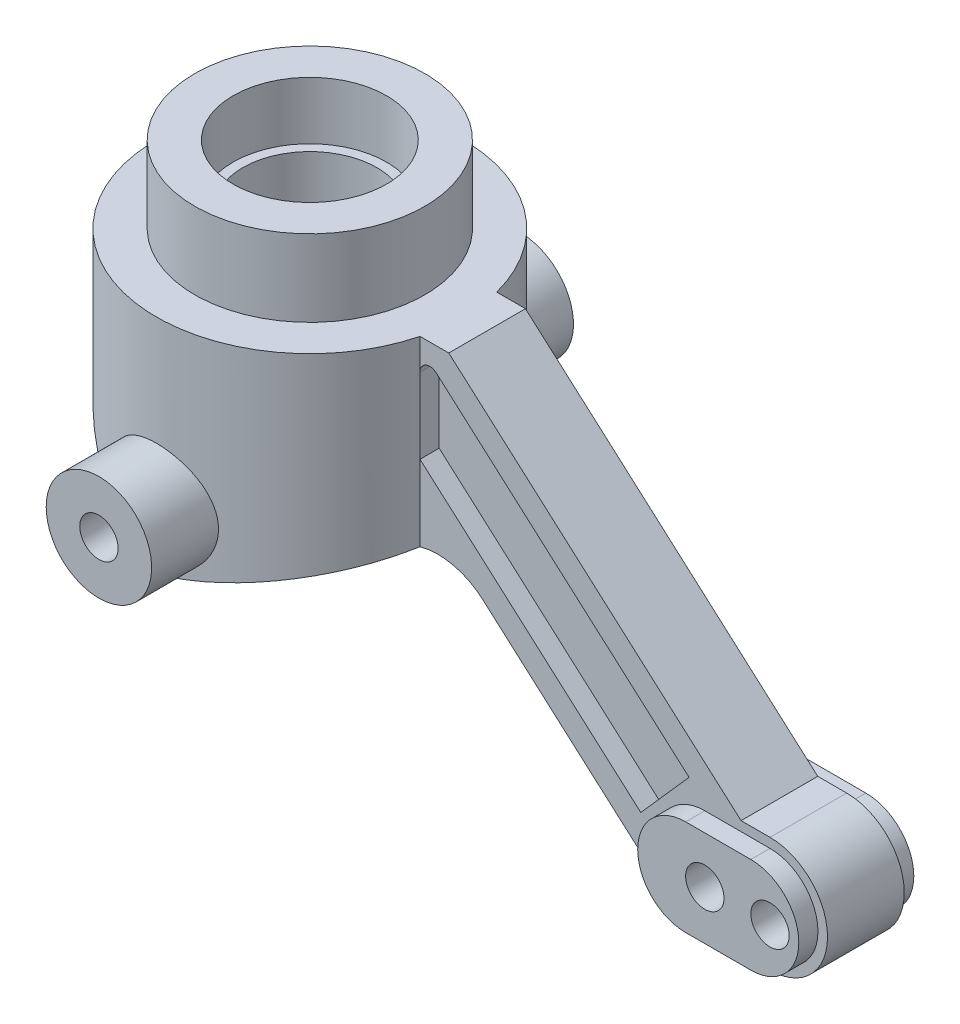
from build123d import *

# Parameters (mm, degrees)
EXTRUDE_1_DEPTH     = 29
CUT_EXTRUDE_1_DEPTH = 29
CUT_EXTRUDE_2_DEPTH = 1
FILLET_1_R          = 0.5
EXTRUDE_2_DEPTH     = 1
SKETCH_7_R          = 2.75
SKETCH_7_R_2        = 1
EXTRUDE_5_DEPTH     = 22
CUT_EXTRUDE_START   = 19
SKETCH_8_R          = 6.25
CUT_EXTRUDE_4_DEPTH = 19
SKETCH_9_R          = 1
CUT_EXTRUDE_5_DEPTH = 18
SKETCH_10_R         = 1
CUT_EXTRUDE_6_DEPTH = 26


with BuildPart() as part:
    # 草图1 → 旋转1 (revolve)
    with BuildSketch(Plane.XY, mode=Mode.PRIVATE) as revolve_1_sk:
        Polygon((4, 0), (4, -3), (3.5, -3), (3.5, -6), (6, -6), (6, -9.5), (6.25, -9.5), (6.25, -16), (8, -16), (8, -4), (6, -4), (6, 0), align=None)
    revolve(revolve_1_sk.sketch.rotate(Axis((0, 0, 0), (0, -1, 0)), 180), axis=Axis((0, 0, 0), (0, -1, 0)))

    # 草图2 → 凸台-拉伸1 (add)
    with BuildSketch(Plane(origin=(0, -4, 0), x_dir=(1, 0, 0), z_dir=(0, 1, 0))):
        with BuildLine():
            Line((7.745966692, 2), (32, 2))
            Line((32, 2), (32, -2))
            Line((32, -2), (7.745966692, -2))
            ThreePointArc((7.745966692, -2), (8, 0), (7.745966692, 2))
        make_face()
    extrude(amount=-EXTRUDE_1_DEPTH)

    # 草图3 → 切除-拉伸1 (cut)
    with BuildSketch(Plane(origin=(0, 0, -12), x_dir=(-1, 0, 0), z_dir=(0, 0, -1))):
        with BuildLine():
            Line((8, -10), (1.860452447, -14.853447831))
            ThreePointArc((1.860452447, -14.853447831), (0.600535009, -15.439278432), (-0.788203157, -15.394604599))
            Line((-0.788203157, -15.394604599), (-7.745966692, -13.5))
            ThreePointArc((-7.745966692, -13.5), (-9.489135576, -13.468262993), (-11.037904709, -14.26886225))
            Line((-11.037904709, -14.26886225), (-20.611161345, -22.746001069))
            ThreePointArc((-20.611161345, -22.746001069), (-21.536515916, -23.305174077), (-22.6, -23.5))
            Line((-22.6, -23.5), (-26, -23.5))
            ThreePointArc((-26, -23.5), (-29, -20.5), (-26, -17.5))
            Line((-26, -17.5), (-24.491554542, -17.5))
            Line((-24.491554542, -17.5), (-9.245966692, -4))
            Line((-9.245966692, -4), (-32, -4))
            Line((-32, -4), (-32, -33))
            Line((-32, -33), (-7.745966692, -33))
            Line((-7.745966692, -33), (-7.745966692, -16))
            Line((-7.745966692, -16), (8, -16))
            Line((8, -16), (8, -10))
        make_face()
    extrude(amount=-CUT_EXTRUDE_1_DEPTH, mode=Mode.SUBTRACT)

    # 草图4 → 切除-拉伸2 (cut)
    with BuildSketch(Plane(origin=(0, 0, -2), x_dir=(-1, 0, 0), z_dir=(0, 0, -1))):
        with BuildLine():
            Line((-19.26013767, -19.746461933), (-21.7793333, -16.901527245))
            Line((-21.7793333, -16.901527245), (-8.595436654, -5.227159128))
            ThreePointArc((-8.595436654, -5.227159128), (-8.047086067, -5.143800877), (-7.745966692, -5.609594916))
            Line((-7.745966692, -5.609594916), (-7.745966692, -9.550639395))
            Line((-7.745966692, -9.550639395), (-19.26013767, -19.746461933))
        make_face()
    cut_extrude_2 = extrude(amount=-CUT_EXTRUDE_2_DEPTH, mode=Mode.SUBTRACT)

    # 圆角1
    fillet_1_edges = [part.edges().sort_by_distance(p)[0] for p in [
        (19.26013767, -19.746461933, -1.5),
        (21.7793333, -16.901527245, -1.5),
    ]]
    fillet(fillet_1_edges, radius=FILLET_1_R)

    # 草图5 → 凸台-拉伸2 (add)
    with BuildSketch(Plane(origin=(0, 0, -2), x_dir=(-1, 0, 0), z_dir=(0, 0, -1))):
        with BuildLine():
            Line((-22.6, -23), (-26, -23))
            ThreePointArc((-26, -23), (-28.5, -20.5), (-26, -18))
            Line((-26, -18), (-22.6, -18))
            ThreePointArc((-22.6, -18), (-20.1, -20.5), (-22.6, -23))
        make_face()
    extrude_2 = extrude(amount=EXTRUDE_2_DEPTH)

    # 镜向1: 切除-拉伸2, 凸台-拉伸2 across plane
    add(cut_extrude_2.mirror(Plane(origin=(0, 0, 0), x_dir=(1, 0, 0), z_dir=(0, 0, -1))), mode=Mode.SUBTRACT)
    add(extrude_2.mirror(Plane(origin=(0, 0, 0), x_dir=(1, 0, 0), z_dir=(0, 0, -1))))

    # 草图7 → 凸台-拉伸5 (add)
    with BuildSketch(Plane(origin=(0, 0, -11), x_dir=(-1, 0, 0), z_dir=(0, 0, -1))):
        with Locations((0, -12.45)):
            Circle(SKETCH_7_R)
        with Locations((0, -12.45)):
            Circle(SKETCH_7_R_2, mode=Mode.SUBTRACT)
    extrude(amount=-EXTRUDE_5_DEPTH)

    # 草图8 → 切除-拉伸4 (cut)
    with BuildSketch(Plane.XZ.offset(9.5).offset(CUT_EXTRUDE_START)):
        with Locations(Location((0, 0, 0), (0, 0, 180))):
            Circle(SKETCH_8_R)
    extrude(amount=-CUT_EXTRUDE_4_DEPTH, mode=Mode.SUBTRACT)

    # 草图9 → 切除-拉伸5 (cut)
    with BuildSketch(Plane(origin=(0, 0, -3), x_dir=(-1, 0, 0), z_dir=(0, 0, -1))):
        with Locations((-27, -20.45)):
            Circle(SKETCH_9_R)
        with Locations((-23.6, -20.45)):
            Circle(SKETCH_9_R)
    extrude(amount=-CUT_EXTRUDE_5_DEPTH, mode=Mode.SUBTRACT)

    # 草图10 → 切除-拉伸6 (cut)
    with BuildSketch(Plane(origin=(0, 0, -11), x_dir=(-1, 0, 0), z_dir=(0, 0, -1))):
        with Locations((0, -12.45)):
            Circle(SKETCH_10_R)
    extrude(amount=-CUT_EXTRUDE_6_DEPTH, mode=Mode.SUBTRACT)


solid = part.part
